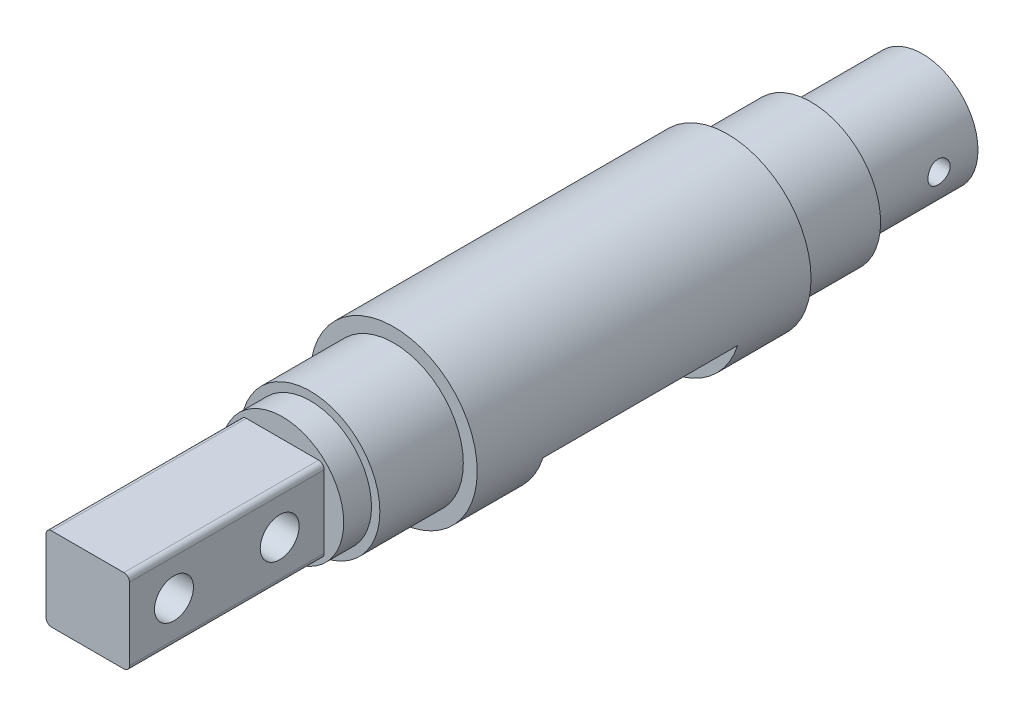
from build123d import *

# Parameters (mm, degrees)
SKETCH_1_R          = 10
EXTRUDE_1_DEPTH     = 20
SKETCH_2_R          = 12.5
EXTRUDE_2_DEPTH     = 15
SKETCH_3_R          = 15
EXTRUDE_3_DEPTH     = 60
SKETCH_4_R          = 12.5
EXTRUDE_4_DEPTH     = 15
SKETCH_5_R          = 11
EXTRUDE_5_DEPTH     = 5
SKETCH_6_W          = 15
SKETCH_6_H          = 15
EXTRUDE_6_DEPTH     = 35
SKETCH_7_R          = 3
CUT_EXTRUDE_1_DEPTH = 20
SKETCH_8_R          = 2
CUT_EXTRUDE_2_DEPTH = 20
SKETCH_9_W          = 35
SKETCH_9_H          = 10.5
CUT_EXTRUDE_3_DEPTH = 20
SKETCH_10_R         = 3.5
CUT_EXTRUDE_4_DEPTH = 20
FILLET_1_R          = 1


with BuildPart() as part:
    # 草图1 → 凸台-拉伸1 (new body)
    with BuildSketch(Plane.XY):
        Circle(SKETCH_1_R)
    extrude(amount=EXTRUDE_1_DEPTH)

    # 草图2 → 凸台-拉伸2 (add)
    with BuildSketch(Plane.XY.offset(20)):
        Circle(SKETCH_2_R)
    extrude(amount=EXTRUDE_2_DEPTH)

    # 草图3 → 凸台-拉伸3 (add)
    with BuildSketch(Plane.XY.offset(35)):
        Circle(SKETCH_3_R)
    extrude(amount=EXTRUDE_3_DEPTH)

    # 草图4 → 凸台-拉伸4 (add)
    with BuildSketch(Plane.XY.offset(95)):
        Circle(SKETCH_4_R)
    extrude(amount=EXTRUDE_4_DEPTH)

    # 草图5 → 凸台-拉伸5 (add)
    with BuildSketch(Plane.XY.offset(110)):
        Circle(SKETCH_5_R)
    extrude(amount=EXTRUDE_5_DEPTH)

    # 草图6 → 凸台-拉伸6 (add)
    with BuildSketch(Plane.XY.offset(115)):
        Rectangle(SKETCH_6_W, SKETCH_6_H)
    extrude(amount=EXTRUDE_6_DEPTH)

    # 草图7 → 切除-拉伸1 (cut)
    with BuildSketch(Plane(origin=(0, 0, 0), x_dir=(-1, 0, 0), z_dir=(0, 0, -1))):
        Circle(SKETCH_7_R)
    extrude(amount=-CUT_EXTRUDE_1_DEPTH, mode=Mode.SUBTRACT)

    # 草图8 → 切除-拉伸2 (cut, symmetric)
    with BuildSketch(Plane(origin=(0, 0, 0), x_dir=(0, 0, -1), z_dir=(1, 0, 0))):
        with Locations((-7, 0)):
            Circle(SKETCH_8_R)
    extrude(amount=CUT_EXTRUDE_2_DEPTH, both=True, mode=Mode.SUBTRACT)

    # 草图9 → 切除-拉伸3 (cut, symmetric)
    with BuildSketch(Plane(origin=(0, 0, 0), x_dir=(0, 0, -1), z_dir=(1, 0, 0))):
        with Locations((-65, -9.75)):
            Rectangle(SKETCH_9_W, SKETCH_9_H)
    extrude(amount=CUT_EXTRUDE_3_DEPTH, both=True, mode=Mode.SUBTRACT)

    # 草图10 → 切除-拉伸4 (cut, symmetric)
    with BuildSketch(Plane(origin=(0, 0, 0), x_dir=(0, 0, -1), z_dir=(1, 0, 0))):
        with Locations((-142, 0)):
            Circle(SKETCH_10_R)
        with Locations((-123, 0)):
            Circle(SKETCH_10_R)
    extrude(amount=CUT_EXTRUDE_4_DEPTH, both=True, mode=Mode.SUBTRACT)

    # 圆角1
    fillet_1_edges = [part.edges().sort_by_distance(p)[0] for p in [
        (-7.5, 7.5, 132.5),
        (-7.5, -7.5, 132.5),
        (7.5, -7.5, 132.5),
        (7.5, 7.5, 132.5),
    ]]
    fillet(fillet_1_edges, radius=FILLET_1_R)


solid = part.part
